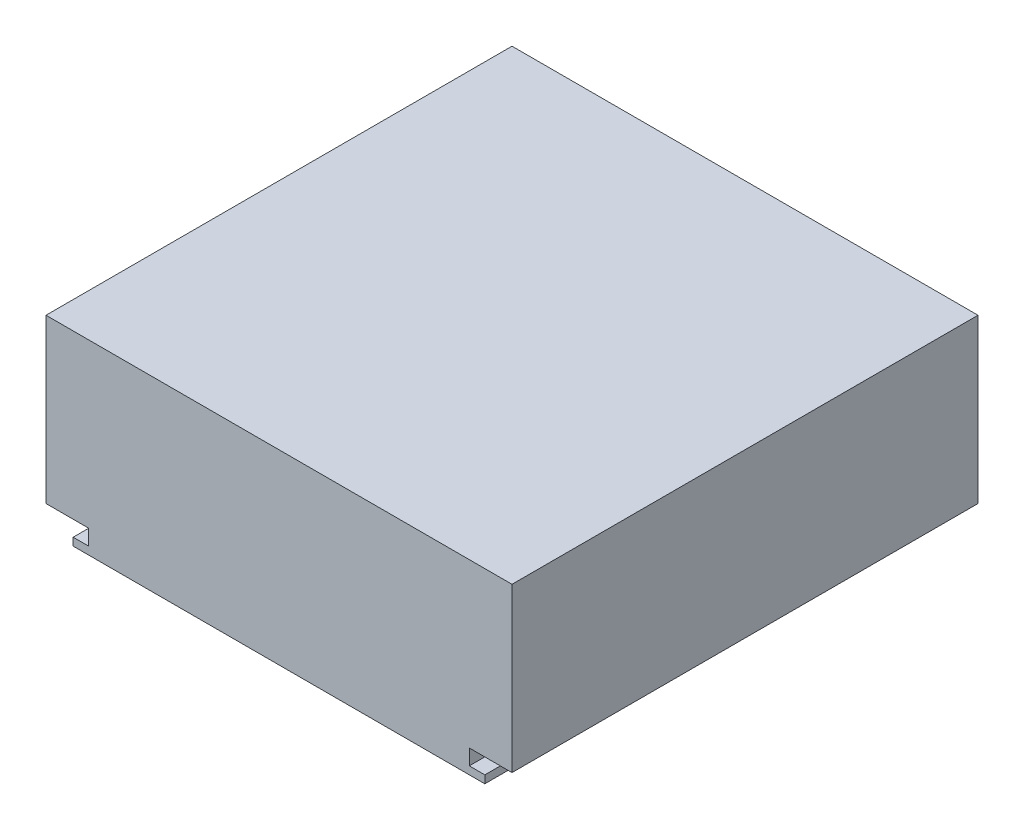
from build123d import *

# Parameters (mm, degrees)
BOSS_EXTRUDE1_DEPTH = 30
BOSS_EXTRUDE2_START = 2.175
SKETCH2_R           = 1.55
BOSS_EXTRUDE2_DEPTH = 5


with BuildPart() as part:
    # Sketch1 → Boss-Extrude1 (new, symmetric)
    with BuildSketch(Plane.XY):
        Polygon((-26.5, 1), (-26.5, 0), (26.5, 0), (26.5, 1), (24.5, 1), (24.5, 3), (30, 3), (30, 24), (-30, 24), (-30, 3), (-24.5, 3), (-24.5, 1), align=None)
    extrude(amount=BOSS_EXTRUDE1_DEPTH, both=True)

    # Sketch2 → Boss-Extrude2 (add)
    with BuildSketch(Plane(origin=(0, 0, 0), x_dir=(0, 0, -1), z_dir=(1, 0, 0)).offset(BOSS_EXTRUDE2_START)):
        with BuildLine():
            ThreePointArc((36.015485064, 2.124014936), (37.798326563, 3.786794145), (37.793319851, 6.224689434))
            Line((37.793319851, 6.224689434), (30, 24))
            Line((30, 24), (30, 0))
            Line((30, 0), (36.015485064, 2.124014936))
        make_face()
        with Locations((35, 5)):
            Circle(SKETCH2_R, mode=Mode.SUBTRACT)
    extrude(amount=BOSS_EXTRUDE2_DEPTH)


solid = part.part
